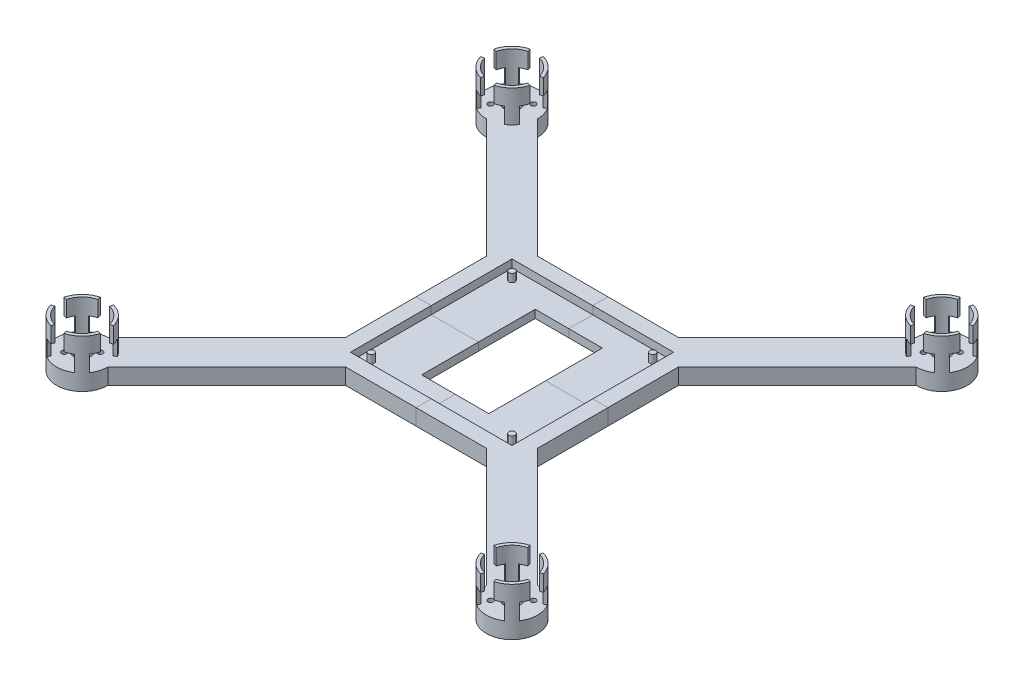
from build123d import *

# Parameters (mm, degrees)
SKETCH_1_R                       = 5.1
SKETCH_1_R_2                     = 1.65
SKETCH_1_W                       = 42
SKETCH_1_H                       = 71
EXTRUDE_2_DEPTH                  = 10
SKETCH_2_W                       = 101
SKETCH_2_H                       = 101
CUT_EXTRUDE_1_DEPTH              = 5
EXTRUDE_START                    = -5
SKETCH_3_R                       = 1.9
EXTRUDE_3_DEPTH                  = 5
EXTRUDE_START_2                  = 20
SKETCH_5_R                       = 16
SKETCH_5_R_2                     = 14
EXTRUDE_4_DEPTH                  = 20
CUT_EXTRUDE_START                = 10
CUT_EXTRUDE_2_DEPTH              = 10
CUT_EXTRUDE_3_DEPTH              = 214.5659581
PATTERN_CIRCULAR_4_COUNT         = 4
SPLIT_BODIES_2_SURFACE_1_1_BACK  = 427.312
SPLIT_BODIES_2_SURFACE_1_1_DEPTH = 854.624
SPLIT_BODIES_2_SURFACE_1_2_BACK  = 427.312
SPLIT_BODIES_2_SURFACE_1_2_DEPTH = 854.624
SPLIT_BODIES_2_SURFACE_2_3_BACK  = 427.312
SPLIT_BODIES_2_SURFACE_2_3_DEPTH = 854.624
SPLIT_BODIES_2_SURFACE_2_4_BACK  = 427.312
SPLIT_BODIES_2_SURFACE_2_4_DEPTH = 854.624
SPLIT_BODIES_2_SURFACE_2_5_BACK  = 427.312
SPLIT_BODIES_2_SURFACE_2_5_DEPTH = 854.624
SPLIT_BODIES_2_SURFACE_2_6_BACK  = 427.312
SPLIT_BODIES_2_SURFACE_2_6_DEPTH = 854.624


with BuildPart() as part:
    # 스케치1 → 보스-돌출2 (new body)
    with BuildSketch(Plane(origin=(0, 0, 0), x_dir=(1, 0, 0), z_dir=(0, 1, 0))):
        with BuildLine():
            Line((134.350288425, -118.350288425), (60, -44))
            Line((60, -44), (60, 44))
            Line((60, 44), (134.350288425, 118.350288425))
            ThreePointArc((134.350288425, 118.350288425), (140.473223343, 119.568215905), (145.663996924, 123.036579926))
            ThreePointArc((145.663996924, 123.036579926), (150.350288425, 134.350288425), (145.663996924, 145.663996924))
            ThreePointArc((145.663996924, 145.663996924), (134.350288425, 150.350288425), (123.036579926, 145.663996924))
            ThreePointArc((123.036579926, 145.663996924), (119.568215905, 140.473223343), (118.350288425, 134.350288425))
            Line((118.350288425, 134.350288425), (44, 60))
            Line((44, 60), (-44, 60))
            Line((-44, 60), (-118.350288425, 134.350288425))
            ThreePointArc((-118.350288425, 134.350288425), (-145.663996924, 145.663996924), (-134.350288425, 118.350288425))
            Line((-134.350288425, 118.350288425), (-60, 44))
            Line((-60, 44), (-60, -44))
            Line((-60, -44), (-134.350288425, -118.350288425))
            ThreePointArc((-134.350288425, -118.350288425), (-145.663996924, -145.663996924), (-118.350288425, -134.350288425))
            Line((-118.350288425, -134.350288425), (-44, -60))
            Line((-44, -60), (44, -60))
            Line((44, -60), (118.350288425, -134.350288425))
            ThreePointArc((118.350288425, -134.350288425), (145.663996924, -145.663996924), (134.350288425, -118.350288425))
        make_face()
        with Locations(Location((134.350288425, 134.350288425, 0), (0, 0, 270))):
            Circle(SKETCH_1_R, mode=Mode.SUBTRACT)
        with Locations(Location((140.007142675, 140.007142675, 0), (0, 0, 270))):
            Circle(SKETCH_1_R_2, mode=Mode.SUBTRACT)
        with Locations(Location((141.067802847, 127.632774004, 0), (0, 0, 270))):
            Circle(SKETCH_1_R_2, mode=Mode.SUBTRACT)
        with Locations(Location((127.632774004, 141.067802847, 0), (0, 0, 270))):
            Circle(SKETCH_1_R_2, mode=Mode.SUBTRACT)
        with Locations(Location((128.693434176, 128.693434176, 0), (0, 0, 270))):
            Circle(SKETCH_1_R_2, mode=Mode.SUBTRACT)
        with Locations(Location((134.350288425, -134.350288425, 0), (0, 0, 270))):
            Circle(SKETCH_1_R, mode=Mode.SUBTRACT)
        with Locations(Location((140.007142675, -140.007142675, 0), (0, 0, 270))):
            Circle(SKETCH_1_R_2, mode=Mode.SUBTRACT)
        with Locations(Location((127.632774004, -141.067802847, 0), (0, 0, 270))):
            Circle(SKETCH_1_R_2, mode=Mode.SUBTRACT)
        with Locations(Location((141.067802847, -127.632774004, 0), (0, 0, 270))):
            Circle(SKETCH_1_R_2, mode=Mode.SUBTRACT)
        with Locations(Location((128.693434176, -128.693434176, 0), (0, 0, 270))):
            Circle(SKETCH_1_R_2, mode=Mode.SUBTRACT)
        with Locations(Location((-134.350288425, -134.350288425, 0), (0, 0, 270))):
            Circle(SKETCH_1_R, mode=Mode.SUBTRACT)
        with Locations(Location((-140.007142675, -140.007142675, 0), (0, 0, 270))):
            Circle(SKETCH_1_R_2, mode=Mode.SUBTRACT)
        with Locations(Location((-141.067802847, -127.632774004, 0), (0, 0, 270))):
            Circle(SKETCH_1_R_2, mode=Mode.SUBTRACT)
        with Locations(Location((-127.632774004, -141.067802847, 0), (0, 0, 270))):
            Circle(SKETCH_1_R_2, mode=Mode.SUBTRACT)
        with Locations(Location((-128.693434176, -128.693434176, 0), (0, 0, 270))):
            Circle(SKETCH_1_R_2, mode=Mode.SUBTRACT)
        with Locations(Location((-134.350288425, 134.350288425, 0), (0, 0, 270))):
            Circle(SKETCH_1_R, mode=Mode.SUBTRACT)
        with Locations(Location((-140.007142675, 140.007142675, 0), (0, 0, 270))):
            Circle(SKETCH_1_R_2, mode=Mode.SUBTRACT)
        with Locations(Location((-127.632774004, 141.067802847, 0), (0, 0, 270))):
            Circle(SKETCH_1_R_2, mode=Mode.SUBTRACT)
        with Locations(Location((-141.067802847, 127.632774004, 0), (0, 0, 270))):
            Circle(SKETCH_1_R_2, mode=Mode.SUBTRACT)
        with Locations(Location((-128.693434176, 128.693434176, 0), (0, 0, 270))):
            Circle(SKETCH_1_R_2, mode=Mode.SUBTRACT)
        Rectangle(SKETCH_1_W, SKETCH_1_H, mode=Mode.SUBTRACT)
    extrude(amount=-EXTRUDE_2_DEPTH)

    # 스케치2 → 컷-돌출1 (cut)
    with BuildSketch(Plane(origin=(0, 0, 0), x_dir=(1, 0, 0), z_dir=(0, 1, 0))):
        Rectangle(SKETCH_2_W, SKETCH_2_H)
    extrude(amount=-CUT_EXTRUDE_1_DEPTH, mode=Mode.SUBTRACT)

    # 스케치3 → 보스-돌출3 (add)
    with BuildSketch(Plane(origin=(0, 0, 0), x_dir=(1, 0, 0), z_dir=(0, 1, 0)).offset(EXTRUDE_START)):
        with Locations(Location((-44, 44, 0), (0, 0, 270))):
            Circle(SKETCH_3_R)
        with Locations(Location((44, 44, 0), (0, 0, 270))):
            Circle(SKETCH_3_R)
        with Locations(Location((-44, -44, 0), (0, 0, 270))):
            Circle(SKETCH_3_R)
        with Locations(Location((44, -44, 0), (0, 0, 270))):
            Circle(SKETCH_3_R)
    extrude(amount=EXTRUDE_3_DEPTH)

    # 스케치5 → 보스-돌출4 (add)
    with BuildSketch(Plane(origin=(0, 0, 0), x_dir=(1, 0, 0), z_dir=(0, 1, 0)).offset(EXTRUDE_START_2)):
        with Locations(Location((134.350288425, 134.350288425, 0), (0, 0, 270))):
            Circle(SKETCH_5_R)
        with Locations(Location((134.350288425, 134.350288425, 0), (0, 0, 270))):
            Circle(SKETCH_5_R_2, mode=Mode.SUBTRACT)
    extrude_4 = extrude(amount=-EXTRUDE_4_DEPTH)

    # 스케치6 → 컷-돌출2 (cut)
    with BuildSketch(Plane(origin=(0, 0, 0), x_dir=(1, 0, 0), z_dir=(0, 1, 0)).offset(CUT_EXTRUDE_START)):
        with BuildLine():
            Line((120.946379869, 143.087292226), (134.350288425, 134.350288425))
            Line((134.350288425, 134.350288425), (120.946379869, 125.613284625))
            ThreePointArc((120.946379869, 125.613284625), (118.350288425, 134.350288425), (120.946379869, 143.087292226))
        make_face()
        with BuildLine():
            Line((125.613284625, 120.946379869), (134.350288425, 134.350288425))
            Line((134.350288425, 134.350288425), (143.087292226, 120.946379869))
            ThreePointArc((143.087292226, 120.946379869), (134.350288425, 118.350288425), (125.613284625, 120.946379869))
        make_face()
        with BuildLine():
            Line((147.754196982, 125.613284625), (134.350288425, 134.350288425))
            Line((134.350288425, 134.350288425), (147.754196982, 143.087292226))
            ThreePointArc((147.754196982, 143.087292226), (150.350288425, 134.350288425), (147.754196982, 125.613284625))
        make_face()
        with BuildLine():
            Line((143.087292226, 147.754196982), (134.350288425, 134.350288425))
            Line((134.350288425, 134.350288425), (125.613284625, 147.754196982))
            ThreePointArc((125.613284625, 147.754196982), (134.350288425, 150.350288425), (143.087292226, 147.754196982))
        make_face()
    cut_extrude_2 = extrude(amount=-CUT_EXTRUDE_2_DEPTH, mode=Mode.SUBTRACT)

    # 스케치8 → 컷-돌출3 (cut, through all)
    with BuildSketch(Plane(origin=(0, 0, 0), x_dir=(1, 0, 0), z_dir=(0, 1, 0))):
        with BuildLine():
            Line((134.350288425, 134.350288425), (118.895475205, 138.491393147))
            ThreePointArc((118.895475205, 138.491393147), (118.350288425, 134.350288425), (118.895475205, 130.209183704))
            Line((118.895475205, 130.209183704), (134.350288425, 134.350288425))
        make_face()
        with BuildLine():
            Line((134.350288425, 134.350288425), (149.805101646, 130.209183704))
            ThreePointArc((149.805101646, 130.209183704), (150.350288425, 134.350288425), (149.805101646, 138.491393147))
            Line((149.805101646, 138.491393147), (134.350288425, 134.350288425))
        make_face()
        with BuildLine():
            Line((134.350288425, 134.350288425), (138.491393147, 149.805101646))
            ThreePointArc((138.491393147, 149.805101646), (134.350288425, 150.350288425), (130.209183704, 149.805101646))
            Line((130.209183704, 149.805101646), (134.350288425, 134.350288425))
        make_face()
        with BuildLine():
            Line((134.350288425, 134.350288425), (130.209183704, 118.895475205))
            ThreePointArc((130.209183704, 118.895475205), (134.350288425, 118.350288425), (138.491393147, 118.895475205))
            Line((138.491393147, 118.895475205), (134.350288425, 134.350288425))
        make_face()
    cut_extrude_3 = extrude(amount=CUT_EXTRUDE_3_DEPTH, mode=Mode.SUBTRACT)

    # 원형 패턴4: 보스-돌출4, 컷-돌출2, 컷-돌출3 ×4 about axis
    pattern_circular_4_axis = Axis((0, 0, 0), (0, 1, 0))
    add([extrude_4.rotate(pattern_circular_4_axis, i * 360 / PATTERN_CIRCULAR_4_COUNT) for i in range(1, PATTERN_CIRCULAR_4_COUNT)])
    add([cut_extrude_2.rotate(pattern_circular_4_axis, i * 360 / PATTERN_CIRCULAR_4_COUNT) for i in range(1, PATTERN_CIRCULAR_4_COUNT)], mode=Mode.SUBTRACT)
    add([cut_extrude_3.rotate(pattern_circular_4_axis, i * 360 / PATTERN_CIRCULAR_4_COUNT) for i in range(1, PATTERN_CIRCULAR_4_COUNT)], mode=Mode.SUBTRACT)


with BuildPart() as body_2:
    # Split Bodies 2: the piece behind the surface
    add(part.part)
    # Split Bodies 2 surface 1: a surface, the sketch's curves swept straight by 854.624 mm
    with BuildLine(Plane(origin=(0, 0, 0), x_dir=(1, 0, 0), z_dir=(0, 1, 0)).offset(-SPLIT_BODIES_2_SURFACE_1_1_BACK), mode=Mode.PRIVATE) as split_bodies_2_surface_1_1_path:
        Line((-60, 0), (60, 0))
    split_bodies_2_surface_1_1 = Shell.extrude(split_bodies_2_surface_1_1_path.wire(), (0 * SPLIT_BODIES_2_SURFACE_1_1_DEPTH, 1 * SPLIT_BODIES_2_SURFACE_1_1_DEPTH, 0 * SPLIT_BODIES_2_SURFACE_1_1_DEPTH))
    split(bisect_by=split_bodies_2_surface_1_1, keep=Keep.BOTTOM)


with BuildPart() as part_1:
    add(part.part)

    # Split Bodies 2: split by a surface, the side it looks to stays
    # Split Bodies 2 surface 1: a surface, the sketch's curves swept straight by 854.624 mm
    with BuildLine(Plane(origin=(0, 0, 0), x_dir=(1, 0, 0), z_dir=(0, 1, 0)).offset(-SPLIT_BODIES_2_SURFACE_1_2_BACK), mode=Mode.PRIVATE) as split_bodies_2_surface_1_2_path:
        Line((-60, 0), (60, 0))
    split_bodies_2_surface_1_2 = Shell.extrude(split_bodies_2_surface_1_2_path.wire(), (0 * SPLIT_BODIES_2_SURFACE_1_2_DEPTH, 1 * SPLIT_BODIES_2_SURFACE_1_2_DEPTH, 0 * SPLIT_BODIES_2_SURFACE_1_2_DEPTH))
    split(bisect_by=split_bodies_2_surface_1_2, keep=Keep.TOP)


with BuildPart() as body_3:
    # Split Bodies 2 2: the piece behind the surface
    add(part_1.part)
    # Split Bodies 2 surface 2: a surface, the sketch's curves swept straight by 854.624 mm
    with BuildLine(Plane(origin=(0, 0, 0), x_dir=(1, 0, 0), z_dir=(0, 1, 0)).offset(-SPLIT_BODIES_2_SURFACE_2_3_BACK), mode=Mode.PRIVATE) as split_bodies_2_surface_2_3_path:
        Line((0, -60), (0, 60))
    split_bodies_2_surface_2_3 = Shell.extrude(split_bodies_2_surface_2_3_path.wire(), (0 * SPLIT_BODIES_2_SURFACE_2_3_DEPTH, 1 * SPLIT_BODIES_2_SURFACE_2_3_DEPTH, 0 * SPLIT_BODIES_2_SURFACE_2_3_DEPTH))
    split(bisect_by=split_bodies_2_surface_2_3, keep=Keep.BOTTOM)


with BuildPart() as part_2:
    add(part_1.part)

    # Split Bodies 2 2: split by a surface, the side it looks to stays
    # Split Bodies 2 surface 2: a surface, the sketch's curves swept straight by 854.624 mm
    with BuildLine(Plane(origin=(0, 0, 0), x_dir=(1, 0, 0), z_dir=(0, 1, 0)).offset(-SPLIT_BODIES_2_SURFACE_2_4_BACK), mode=Mode.PRIVATE) as split_bodies_2_surface_2_4_path:
        Line((0, -60), (0, 60))
    split_bodies_2_surface_2_4 = Shell.extrude(split_bodies_2_surface_2_4_path.wire(), (0 * SPLIT_BODIES_2_SURFACE_2_4_DEPTH, 1 * SPLIT_BODIES_2_SURFACE_2_4_DEPTH, 0 * SPLIT_BODIES_2_SURFACE_2_4_DEPTH))
    split(bisect_by=split_bodies_2_surface_2_4, keep=Keep.TOP)


with BuildPart() as body_4:
    # Split Bodies 2 2 body 2: the piece behind the surface
    add(body_2.part)
    # Split Bodies 2 surface 2: a surface, the sketch's curves swept straight by 854.624 mm
    with BuildLine(Plane(origin=(0, 0, 0), x_dir=(1, 0, 0), z_dir=(0, 1, 0)).offset(-SPLIT_BODIES_2_SURFACE_2_5_BACK), mode=Mode.PRIVATE) as split_bodies_2_surface_2_5_path:
        Line((0, -60), (0, 60))
    split_bodies_2_surface_2_5 = Shell.extrude(split_bodies_2_surface_2_5_path.wire(), (0 * SPLIT_BODIES_2_SURFACE_2_5_DEPTH, 1 * SPLIT_BODIES_2_SURFACE_2_5_DEPTH, 0 * SPLIT_BODIES_2_SURFACE_2_5_DEPTH))
    split(bisect_by=split_bodies_2_surface_2_5, keep=Keep.BOTTOM)


with BuildPart() as body_2_1:
    add(body_2.part)

    # Split Bodies 2 2 body 2: split by a surface, the side it looks to stays
    # Split Bodies 2 surface 2: a surface, the sketch's curves swept straight by 854.624 mm
    with BuildLine(Plane(origin=(0, 0, 0), x_dir=(1, 0, 0), z_dir=(0, 1, 0)).offset(-SPLIT_BODIES_2_SURFACE_2_6_BACK), mode=Mode.PRIVATE) as split_bodies_2_surface_2_6_path:
        Line((0, -60), (0, 60))
    split_bodies_2_surface_2_6 = Shell.extrude(split_bodies_2_surface_2_6_path.wire(), (0 * SPLIT_BODIES_2_SURFACE_2_6_DEPTH, 1 * SPLIT_BODIES_2_SURFACE_2_6_DEPTH, 0 * SPLIT_BODIES_2_SURFACE_2_6_DEPTH))
    split(bisect_by=split_bodies_2_surface_2_6, keep=Keep.TOP)


solid = Compound([body_3.part, part_2.part, body_4.part, body_2_1.part])
